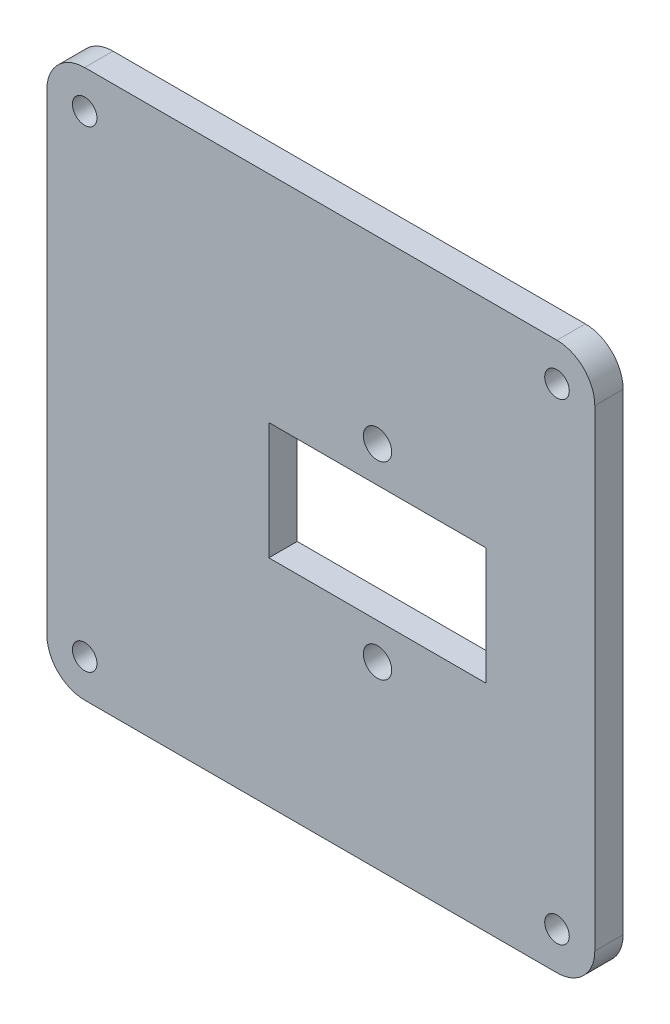
from build123d import *

# Parameters (mm, degrees)
ESBO_O1_W                    = 58
ESBO_O1_H                    = 58
RESSALTO_EXTRUS_O1_DEPTH     = 3
FURO_DE_DI_METRO_2_6_2_6_1_D = 2.6
PERFIL_CORTE_W               = 23
PERFIL_CORTE_H               = 12.4
CORTE_PRINCIPAL_DEPTH        = 85.236965894
FURO_DE_DI_METRO_3_0_3_1_D   = 3
FILETE1_R                    = 4


with BuildPart() as part:
    # Esboço1 → Ressalto-extrusão1 (new body)
    with BuildSketch(Plane.XY):
        Rectangle(ESBO_O1_W, ESBO_O1_H)
    extrude(amount=RESSALTO_EXTRUS_O1_DEPTH)

    # Furo de diâmetro Ø2.6 (2.6)1 (through all)
    with Locations(Plane.XY.offset(3)):
        with Locations((-25, 25), (25, 25), (25, -25), (-25, -25)):
            Hole(FURO_DE_DI_METRO_2_6_2_6_1_D / 2)

    # Perfil Corte → Corte Principal (cut, through all)
    with BuildSketch(Plane(origin=(-34.608741594, -26.143398661, 3), x_dir=(1, 0, 0), z_dir=(0, 0, 1))):
        with Locations((40.608741594, 26.143398661)):
            Rectangle(PERFIL_CORTE_W, PERFIL_CORTE_H)
    extrude(amount=-CORTE_PRINCIPAL_DEPTH, mode=Mode.SUBTRACT)

    # Furo de diâmetro Ø3.0 (3)1 (through all)
    with Locations(Plane(origin=(-55.097814602, -24.42830067, 3), x_dir=(1, 0, 0), z_dir=(0, 0, 1))):
        with Locations((61.097814602, 34.42830067), (61.097814602, 14.42830067)):
            Hole(FURO_DE_DI_METRO_3_0_3_1_D / 2)

    # Filete1
    filete1_edges = [part.edges().sort_by_distance(p)[0] for p in [
        (29, -29, 1.5),
        (-29, -29, 1.5),
        (-29, 29, 1.5),
        (29, 29, 1.5),
    ]]
    fillet(filete1_edges, radius=FILETE1_R)


solid = part.part
